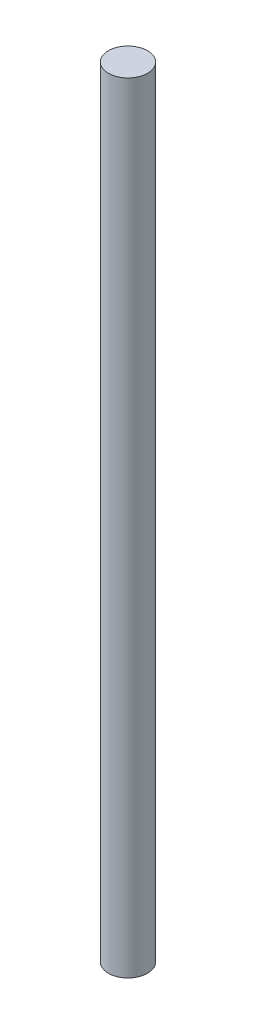
from build123d import *

# Parameters (mm, degrees)
SKIZZE1_R                       = 1.5
AUFSATZ_LINEAR_AUSTRAGEN1_DEPTH = 59.7


with BuildPart() as part:
    # Skizze1 → Aufsatz-Linear austragen1 (new body)
    with BuildSketch(Plane(origin=(0, 0, 0), x_dir=(1, 0, 0), z_dir=(0, 1, 0))):
        with Locations(Location((0, 0, 0), (0, 0, 270))):
            Circle(SKIZZE1_R)
    extrude(amount=AUFSATZ_LINEAR_AUSTRAGEN1_DEPTH)


solid = part.part
